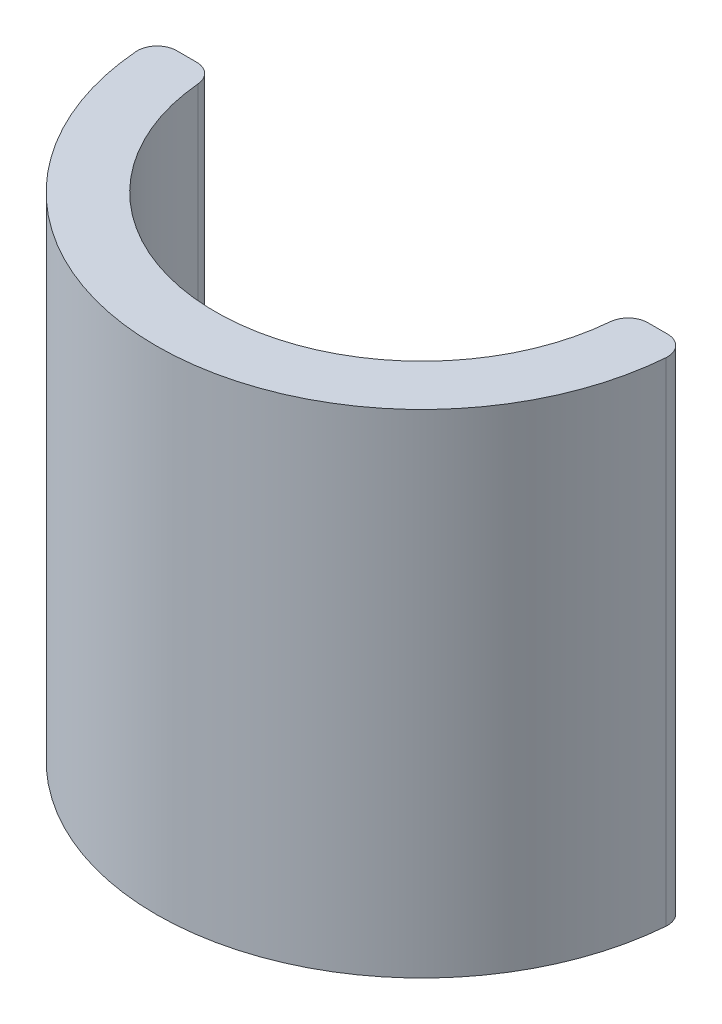
from build123d import *

# Parameters (mm, degrees)
EXTRUDE_1_DEPTH = 25
FILLET_2_R      = 1


with BuildPart() as part:
    # Эскиз1 → Бобышка-Вытянуть1 (new body)
    with BuildSketch(Plane(origin=(0, 0, 0), x_dir=(1, 0, 0), z_dir=(0, 1, 0))):
        with BuildLine():
            Line((-12.459935794, 0), (-11.456439237, 0))
            ThreePointArc((-11.456439237, 0), (-10.780775313, -0.262790219), (-10.46022713, -0.913043478))
            ThreePointArc((-10.46022713, -0.913043478), (0.456954668, -10.49005207), (10.5, 0))
            Line((10.5, 0), (13.5, 0))
            ThreePointArc((13.5, 0), (0.540433214, -13.489178327), (-13.456730658, -1.08))
            ThreePointArc((-13.456730658, -1.08), (-13.194782717, -0.321767002), (-12.459935794, 0))
        make_face()
    extrude(amount=EXTRUDE_1_DEPTH)

    # Скругление2
    fillet_2_edges = [part.edges().sort_by_distance(p)[0] for p in [
        (10.5, 12.5, 0),
        (13.5, 12.5, 0),
    ]]
    fillet(fillet_2_edges, radius=FILLET_2_R)


solid = part.part
